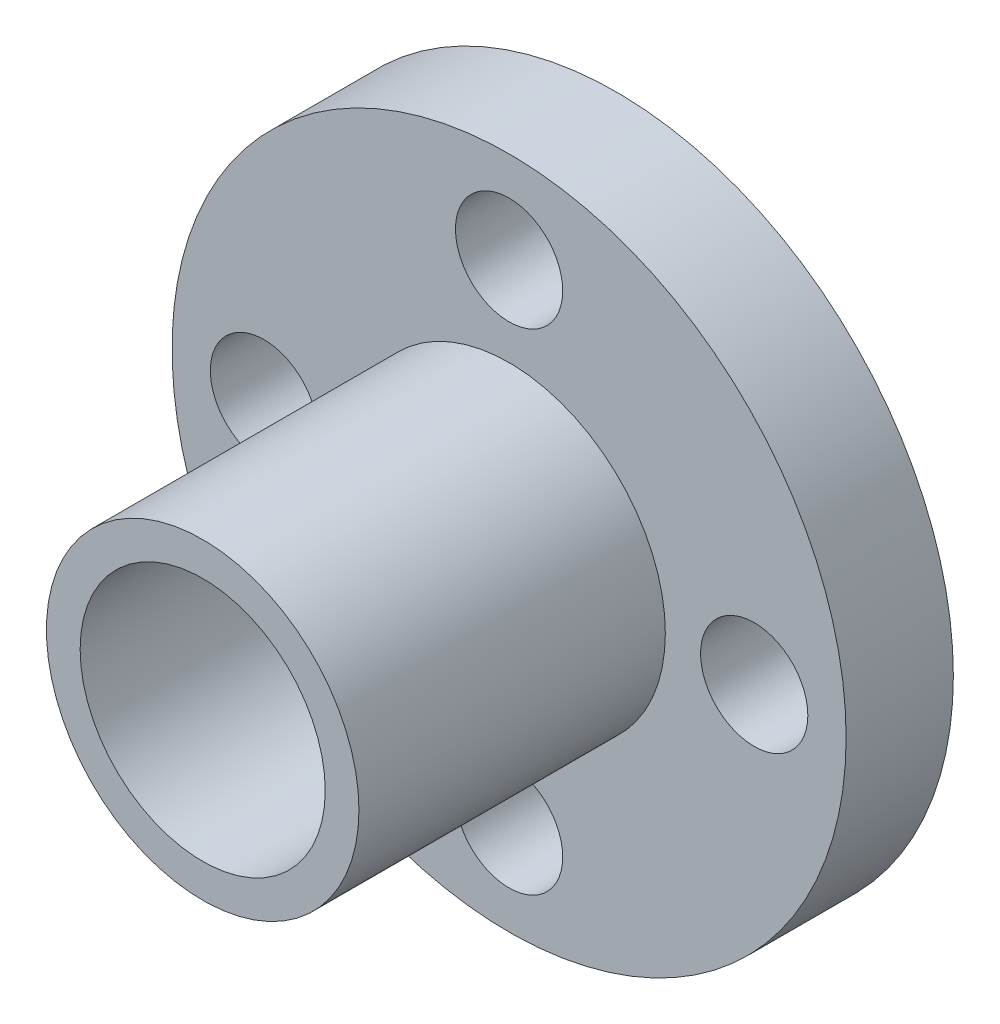
from build123d import *

# Parameters (mm, degrees)
CROQUIS1_R              = 11
SALIENTE_EXTRUIR1_DEPTH = 3.5
CROQUIS2_R              = 5.1
SALIENTE_EXTRUIR2_DEPTH = 10
SALIENTE_EXTRUIR3_START = 1.5
CROQUIS3_R              = 5.1
SALIENTE_EXTRUIR3_DEPTH = 1.5
CROQUIS4_R              = 1.75
CORTAR_EXTRUIR1_DEPTH   = 19.493242009
CROQUIS5_R              = 4
CORTAR_EXTRUIR2_DEPTH   = 22.610182785


with BuildPart() as part:
    # Croquis1 → Saliente-Extruir1 (new body)
    with BuildSketch(Plane.XY):
        Circle(CROQUIS1_R)
    extrude(amount=SALIENTE_EXTRUIR1_DEPTH)

    # Croquis2 → Saliente-Extruir2 (add)
    with BuildSketch(Plane.XY.offset(3.5)):
        Circle(CROQUIS2_R)
    extrude(amount=SALIENTE_EXTRUIR2_DEPTH)

    # Croquis3 → Saliente-Extruir3 (add)
    with BuildSketch(Plane(origin=(0, 0, 0), x_dir=(-1, 0, 0), z_dir=(0, 0, -1)).offset(SALIENTE_EXTRUIR3_START)):
        with Locations(Location((0, 0, 0), (0, 0, 180))):
            Circle(CROQUIS3_R)
    extrude(amount=-SALIENTE_EXTRUIR3_DEPTH)

    # Croquis4 → Cortar-Extruir1 (cut, through all)
    with BuildSketch(Plane.XY.offset(3.5)):
        with Locations((8, 0)):
            Circle(CROQUIS4_R)
        with Locations((0, -8)):
            Circle(CROQUIS4_R)
        with Locations((-8, 0)):
            Circle(CROQUIS4_R)
        with Locations((0, 8)):
            Circle(CROQUIS4_R)
    extrude(amount=-CORTAR_EXTRUIR1_DEPTH, mode=Mode.SUBTRACT)

    # Croquis5 → Cortar-Extruir2 (cut, through all)
    with BuildSketch(Plane.XY.offset(13.5)):
        Circle(CROQUIS5_R)
    extrude(amount=-CORTAR_EXTRUIR2_DEPTH, mode=Mode.SUBTRACT)


solid = part.part
